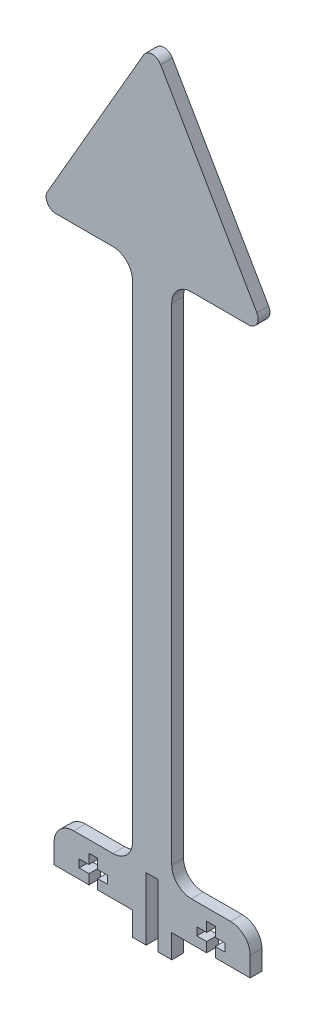
from build123d import *

# Parameters (mm, degrees)
BOSS_EXTRUDE1_DEPTH = 3
FILLET1_R           = 5
FILLET2_R           = 2.5


with BuildPart() as part:
    # Sketch1 → Boss-Extrude1 (new body)
    with BuildSketch(Plane.XY):
        Polygon((-5, -25), (-5, -159), (-25, -159), (-25, -169), (-16.1, -169), (-16.1, -166.5), (-18.6, -166.5), (-18.6, -164.5), (-16.1, -164.5), (-16.1, -162), (-13.9, -162), (-13.9, -164.5), (-11.4, -164.5), (-11.4, -166.5), (-13.9, -166.5), (-13.9, -169), (-5, -169), (-5, -175), (-1.5, -175), (-1.5, -159), (1.5, -159), (1.5, -175), (5, -175), (5, -169), (13.9, -169), (13.9, -166.5), (11.4, -166.5), (11.4, -164.5), (13.9, -164.5), (13.9, -162), (16.1, -162), (16.1, -164.5), (18.6, -164.5), (18.6, -166.5), (16.1, -166.5), (16.1, -169), (25, -169), (25, -159), (5, -159), (5, -25), (28.8675, -25), (0, 25), (-28.8675, -25), align=None)
    extrude(amount=BOSS_EXTRUDE1_DEPTH)

    # Fillet1
    fillet1_edges = [part.edges().sort_by_distance(p)[0] for p in [
        (5, -25, 1.5),
        (5, -159, 1.5),
        (25, -159, 1.5),
        (-25, -159, 1.5),
        (-5, -159, 1.5),
        (-5, -25, 1.5),
    ]]
    fillet(fillet1_edges, radius=FILLET1_R)

    # Fillet2
    fillet2_edges = [part.edges().sort_by_distance(p)[0] for p in [
        (0, 25, 1.5),
        (28.8675, -25, 1.5),
        (-28.8675, -25, 1.5),
    ]]
    fillet(fillet2_edges, radius=FILLET2_R)


solid = part.part
